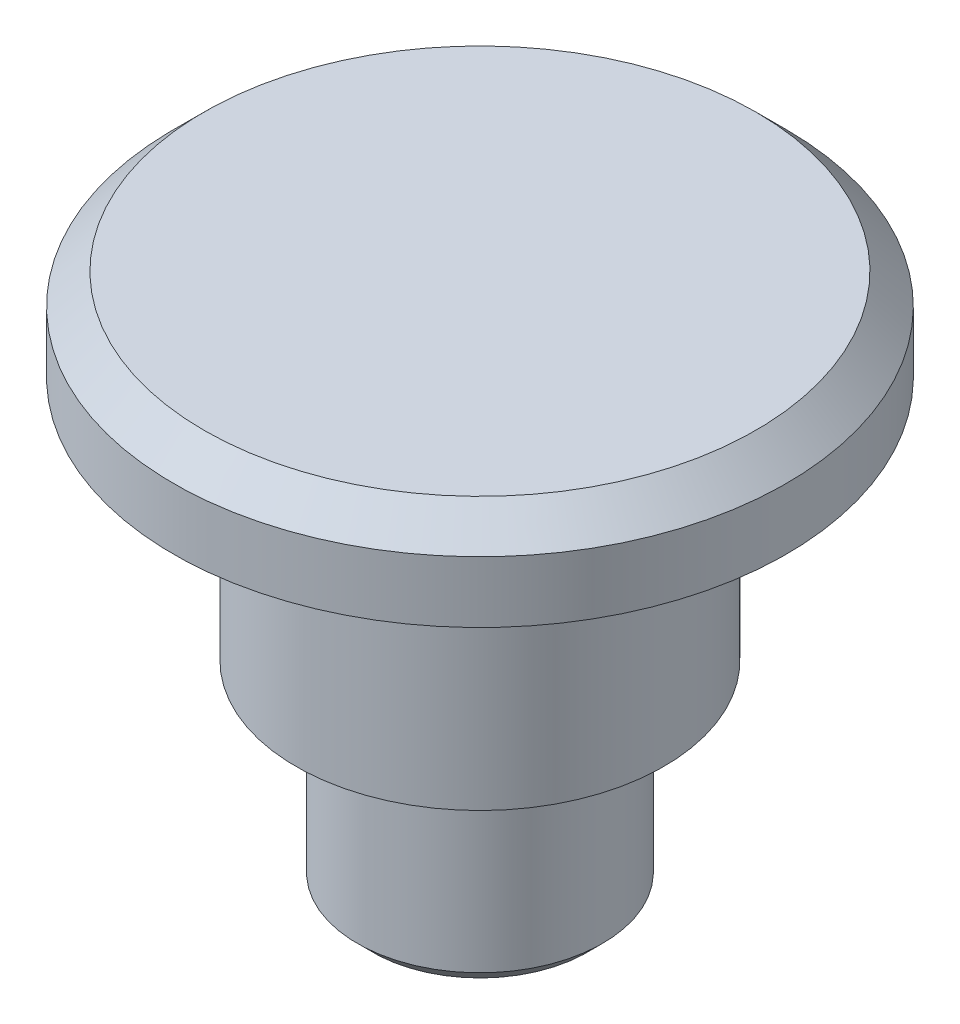
from build123d import *


with BuildPart() as part:
    # Esquisse1 → Base-Révolution (revolve)
    with BuildSketch(Plane.XY, mode=Mode.PRIVATE) as base_r_volution_sk:
        with BuildLine():
            Line((0, 0), (3.5, 0))
            Line((3.5, 0), (4, 0.5))
            Line((4, 0.5), (4, 6.5))
            ThreePointArc((4, 6.5), (4.3, 6.8), (4.6, 6.5))
            Line((4.6, 6.5), (6, 6.5))
            Line((6, 6.5), (6, 14.5))
            ThreePointArc((6, 14.5), (6.3, 14.8), (6.6, 14.5))
            Line((6.6, 14.5), (10, 14.5))
            Line((10, 14.5), (10, 16.5))
            Line((10, 16.5), (9, 17.5))
            Line((9, 17.5), (0, 17.5))
            Line((0, 17.5), (0, 0))
        make_face()
    revolve(base_r_volution_sk.sketch.rotate(Axis((0, 0, 0), (0, 1, 0)), 90), axis=Axis((0, 0, 0), (0, 1, 0)))


solid = part.part
